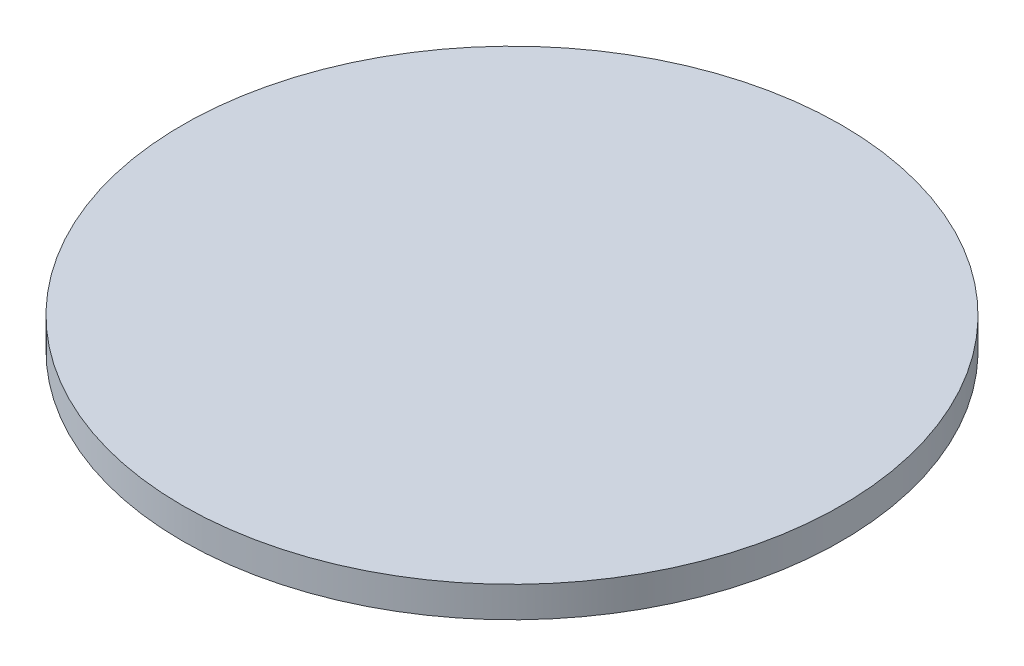
from build123d import *

# Parameters (mm, degrees)
SKETCH1_R           = 32.172453425
BOSS_EXTRUDE1_DEPTH = 3


with BuildPart() as part:
    # Sketch1 → Boss-Extrude1 (new body)
    with BuildSketch(Plane(origin=(0, 0, 0), x_dir=(1, 0, 0), z_dir=(0, 1, 0))):
        with Locations(Location((0, 0, 0), (0, 0, 270))):
            Circle(SKETCH1_R)
    extrude(amount=BOSS_EXTRUDE1_DEPTH)


solid = part.part
